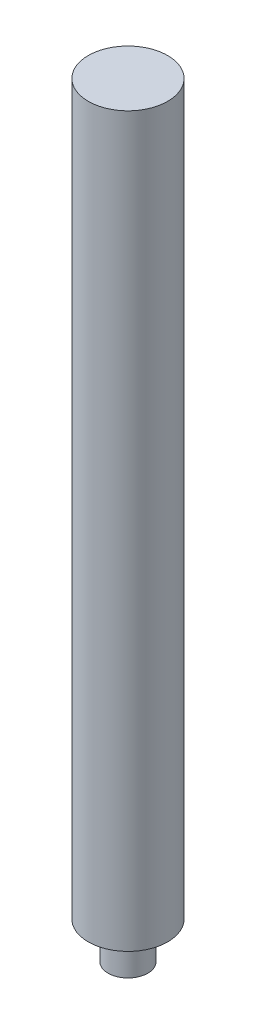
from build123d import *

# Parameters (mm, degrees)
SKETCH_1_R      = 1.5
EXTRUDE_1_DEPTH = 2.8
SKETCH_2_R      = 3
EXTRUDE_2_DEPTH = 55


with BuildPart() as part:
    # 草圖1 → 填料-伸長1 (new body)
    with BuildSketch(Plane(origin=(0, 0, 0), x_dir=(1, 0, 0), z_dir=(0, 1, 0))):
        with Locations(Location((0, 0, 0), (0, 0, 270))):
            Circle(SKETCH_1_R)
    extrude(amount=EXTRUDE_1_DEPTH)

    # 草圖2 → 填料-伸長2 (add)
    with BuildSketch(Plane(origin=(0, 2.8, 0), x_dir=(1, 0, 0), z_dir=(0, 1, 0))):
        with Locations(Location((0, 0, 0), (0, 0, 270))):
            Circle(SKETCH_2_R)
    extrude(amount=EXTRUDE_2_DEPTH)


solid = part.part
